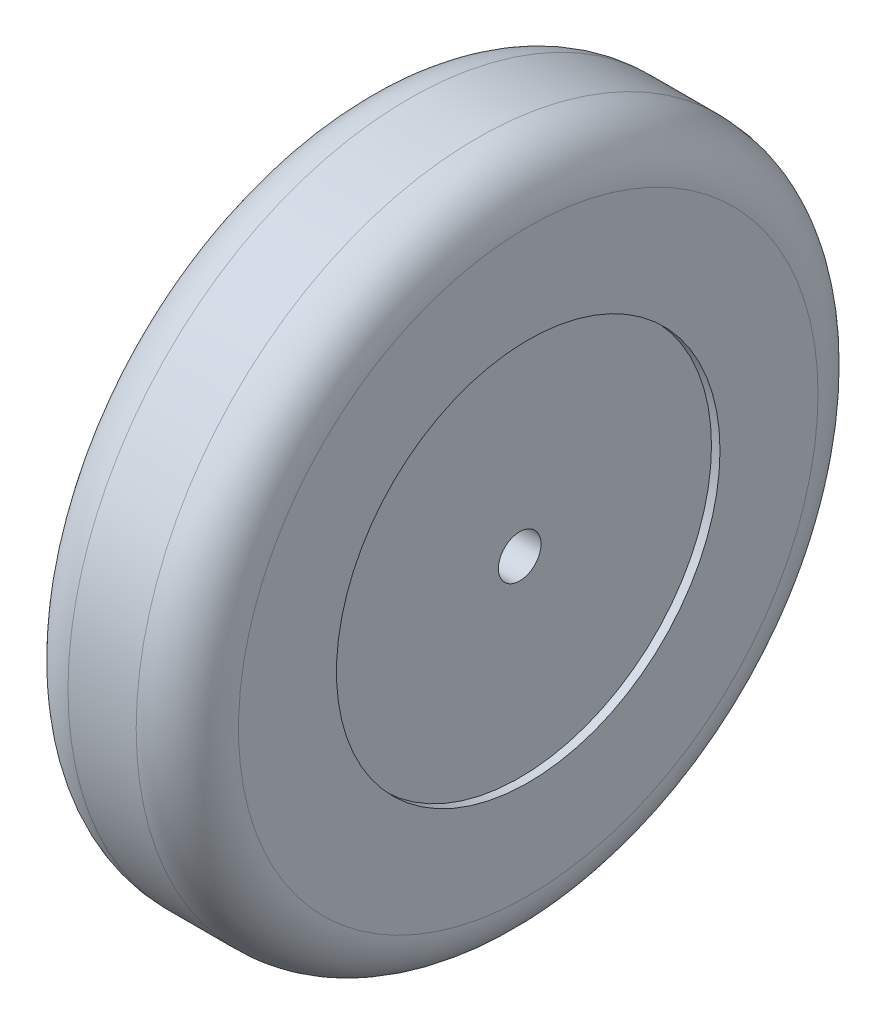
from build123d import *

# Parameters (mm, degrees)
SKETCH1_R           = 50.8
BOSS_EXTRUDE1_DEPTH = 12.7
SKETCH2_R           = 3.175
CUT_EXTRUDE1_DEPTH  = 77.2
FILLET1_R           = 7.62
SKETCH3_R           = 28.575
CUT_EXTRUDE2_DEPTH  = 1.27


with BuildPart() as part:
    # Sketch1 → Boss-Extrude1 (new, symmetric)
    with BuildSketch(Plane(origin=(0, 0, 0), x_dir=(0, 0, -1), z_dir=(1, 0, 0))):
        Circle(SKETCH1_R)
    extrude(amount=BOSS_EXTRUDE1_DEPTH, both=True)

    # Sketch2 → Cut-Extrude1 (cut, through all)
    with BuildSketch(Plane(origin=(12.7, 0, 0), x_dir=(0, 0, -1), z_dir=(1, 0, 0))):
        Circle(SKETCH2_R)
    extrude(amount=-CUT_EXTRUDE1_DEPTH, mode=Mode.SUBTRACT)

    # Fillet1
    fillet1_edges = [part.edges().sort_by_distance(p)[0] for p in [
        (-12.7, 0, 50.8),
        (12.7, 0, 50.8),
    ]]
    fillet(fillet1_edges, radius=FILLET1_R)

    # Sketch3 → Cut-Extrude2 (cut)
    with BuildSketch(Plane(origin=(12.7, 0, 0), x_dir=(0, 0, -1), z_dir=(1, 0, 0))):
        Circle(SKETCH3_R)
    cut_extrude2 = extrude(amount=-CUT_EXTRUDE2_DEPTH, mode=Mode.SUBTRACT)

    # Mirror1: Cut-Extrude2 across plane
    add(cut_extrude2.mirror(Plane(origin=(0, 0, 0), x_dir=(0, 0, 1), z_dir=(1, 0, 0))), mode=Mode.SUBTRACT)


solid = part.part
